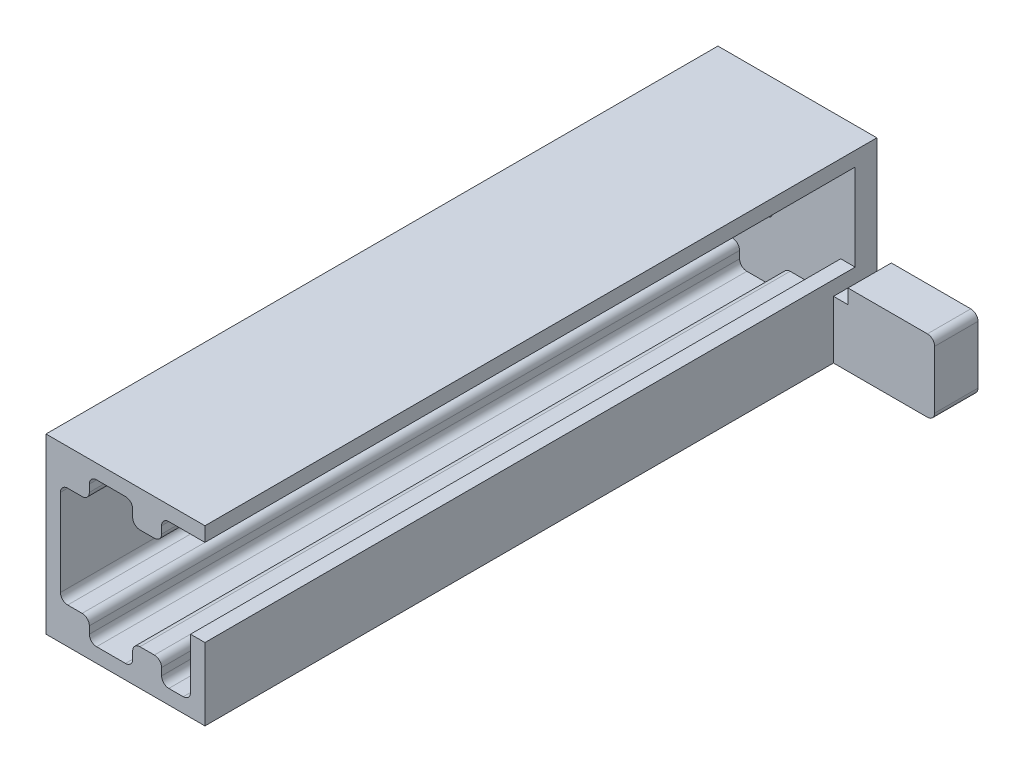
from build123d import *

# Parameters (mm, degrees)
BOSS_EXTRUDE1_DEPTH = 114.3
SKETCH6_W           = 27.94
SKETCH6_H           = 30.48
BOSS_EXTRUDE5_DEPTH = 3.81
SKETCH8_W           = 7.62
SKETCH8_H           = 12.7
BOSS_EXTRUDE6_DEPTH = 17.78
SKETCH9_W           = 2.54
SKETCH9_H           = 10.16
BOSS_EXTRUDE7_DEPTH = 114.3
SKETCH10_W          = 2.54
SKETCH10_H          = 2.54
CUT_EXTRUDE2_DEPTH  = 124.399306724
SKETCH11_R          = 0.635
CUT_EXTRUDE3_DEPTH  = 127.822075365
FILLET3_R           = 1.27
FILLET4_R           = 1.27


with BuildPart() as part:
    # Sketch1 → Boss-Extrude1 (new body)
    with BuildSketch(Plane.XY):
        Polygon((27.94, 30.48), (27.94, 27.94), (20.32, 27.94), (20.32, 24.13), (15.24, 24.13), (15.24, 27.94), (7.62, 27.94), (7.62, 24.13), (2.54, 24.13), (2.54, 6.35), (7.62, 6.35), (7.62, 2.54), (15.24, 2.54), (15.24, 6.35), (20.32, 6.35), (20.32, 2.54), (27.94, 2.54), (27.94, 0), (0, 0), (0, 30.48), align=None)
    extrude(amount=BOSS_EXTRUDE1_DEPTH)

    # Sketch6 → Boss-Extrude5 (add)
    with BuildSketch(Plane(origin=(0, 0, 0), x_dir=(-1, 0, 0), z_dir=(0, 0, -1))):
        with Locations((-13.97, 15.24)):
            Rectangle(SKETCH6_W, SKETCH6_H)
    extrude(amount=BOSS_EXTRUDE5_DEPTH)

    # Sketch8 → Boss-Extrude6 (add)
    with BuildSketch(Plane(origin=(27.94, 0, 0), x_dir=(0, 0, -1), z_dir=(1, 0, 0))):
        with Locations((0, 6.35)):
            Rectangle(SKETCH8_W, SKETCH8_H)
    extrude(amount=BOSS_EXTRUDE6_DEPTH)

    # Sketch9 → Boss-Extrude7 (add, through all)
    with BuildSketch(Plane.XY):
        with Locations((26.67, 7.62)):
            Rectangle(SKETCH9_W, SKETCH9_H)
    extrude(amount=BOSS_EXTRUDE7_DEPTH)

    # Sketch10 → Cut-Extrude2 (cut, through all)
    with BuildSketch(Plane.XY.offset(3.81)):
        with Locations((29.21, 11.43)):
            Rectangle(SKETCH10_W, SKETCH10_H)
    extrude(amount=-CUT_EXTRUDE2_DEPTH, mode=Mode.SUBTRACT)

    # Sketch11 → Cut-Extrude3 (cut, through all)
    with BuildSketch(Plane.XY):
        with Locations((10.16, 13.41906471)):
            Circle(SKETCH11_R)
        with Locations((12.7, 13.41906471)):
            Circle(SKETCH11_R)
    extrude(amount=-CUT_EXTRUDE3_DEPTH, mode=Mode.SUBTRACT)

    # Fillet3
    fillet3_edges = [part.edges().sort_by_distance(p)[0] for p in [
        (20.32, 27.94, 57.15),
        (20.32, 24.13, 57.15),
        (15.24, 24.13, 57.15),
        (15.24, 27.94, 57.15),
        (7.62, 27.94, 57.15),
        (7.62, 24.13, 57.15),
        (2.54, 24.13, 57.15),
        (2.54, 6.35, 57.15),
        (7.62, 6.35, 57.15),
        (7.62, 2.54, 57.15),
        (15.24, 2.54, 57.15),
        (15.24, 6.35, 57.15),
        (20.32, 6.35, 57.15),
        (20.32, 2.54, 57.15),
        (25.4, 2.54, 57.15),
    ]]
    fillet(fillet3_edges, radius=FILLET3_R)

    # Fillet4
    fillet4_edges = [part.edges().sort_by_distance(p)[0] for p in [
        (45.72, 0, 0),
        (45.72, 12.7, 0),
    ]]
    fillet(fillet4_edges, radius=FILLET4_R)


solid = part.part
